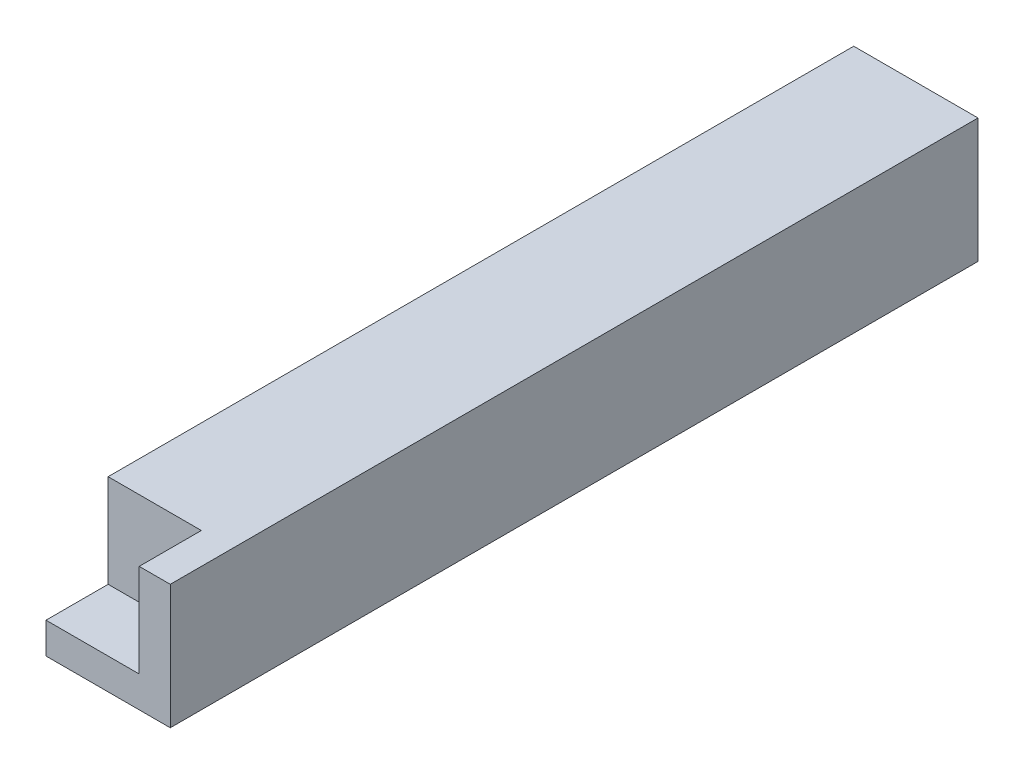
from build123d import *

# Parameters (mm, degrees)
SKETCH1_W           = 10
SKETCH1_H           = 10
BOSS_EXTRUDE1_DEPTH = 65
CUT_EXTRUDE1_DEPTH  = 5


with BuildPart() as part:
    # Sketch1 → Boss-Extrude1 (new body)
    with BuildSketch(Plane.XY):
        with Locations((-11.829268293, -0.975609756)):
            Rectangle(SKETCH1_W, SKETCH1_H)
    extrude(amount=BOSS_EXTRUDE1_DEPTH)

    # Sketch2 → Cut-Extrude1 (cut)
    with BuildSketch(Plane.XY.offset(65)):
        Polygon((-9.329268293, 1.524390244), (-11.829268293, 4.024390244), (-16.829268293, 4.024390244), (-16.829268293, -3.475609756), (-9.329268293, -3.475609756), align=None)
        Polygon((-9.329268293, 4.024390244), (-11.829268293, 4.024390244), (-9.329268293, 1.524390244), align=None)
    extrude(amount=-CUT_EXTRUDE1_DEPTH, mode=Mode.SUBTRACT)


solid = part.part
